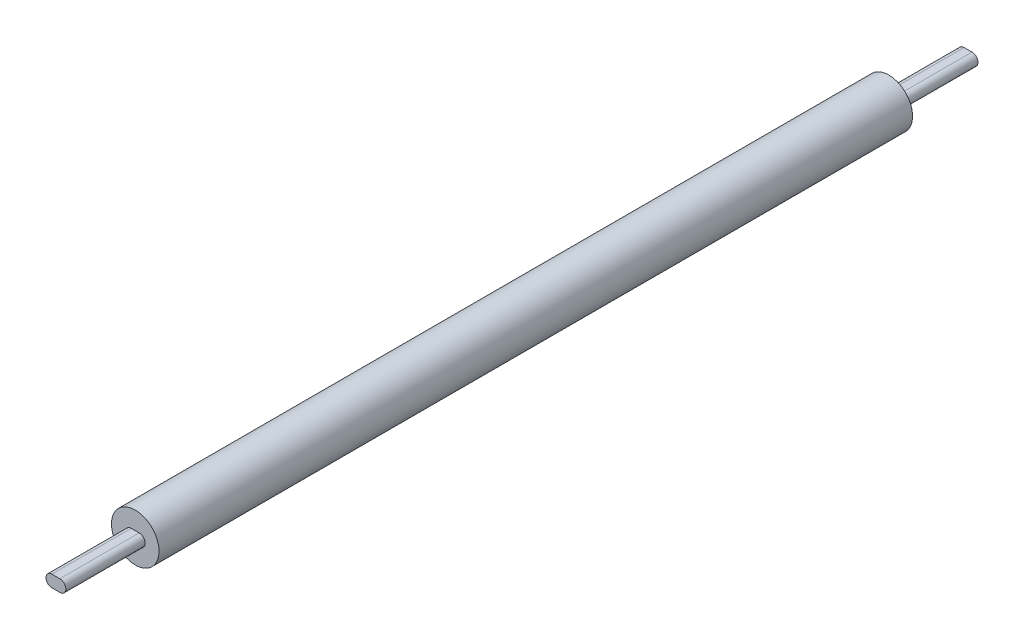
from build123d import *

# Parameters (mm, degrees)
ESQUISSE1_R        = 6
BOSS_EXTRU_1_DEPTH = 190
BOSS_EXTRU_2_DEPTH = 20
BOSS_EXTRU_3_START = 20
BOSS_EXTRU_3_DEPTH = 20


with BuildPart() as part:
    # Esquisse1 → Boss.-Extru.1 (new body)
    with BuildSketch(Plane.XY):
        Circle(ESQUISSE1_R)
    extrude(amount=BOSS_EXTRU_1_DEPTH)

    # Esquisse2 → Boss.-Extru.2 (add)
    with BuildSketch(Plane.XY.offset(190)):
        with BuildLine():
            Line((-1, 1.5), (1, 1.5))
            ThreePointArc((1, 1.5), (2.5, 0), (1, -1.5))
            Line((1, -1.5), (-1, -1.5))
            ThreePointArc((-1, -1.5), (-2.5, 0), (-1, 1.5))
        make_face()
    extrude(amount=BOSS_EXTRU_2_DEPTH)

    # Esquisse3 → Boss.-Extru.3 (add)
    with BuildSketch(Plane(origin=(0, 0, 0), x_dir=(-1, 0, 0), z_dir=(0, 0, -1)).offset(BOSS_EXTRU_3_START)):
        with BuildLine():
            Line((-1, 1.5), (1, 1.5))
            ThreePointArc((1, 1.5), (2.5, 0), (1, -1.5))
            Line((1, -1.5), (-1, -1.5))
            ThreePointArc((-1, -1.5), (-2.5, 0), (-1, 1.5))
        make_face()
    extrude(amount=-BOSS_EXTRU_3_DEPTH)


solid = part.part
